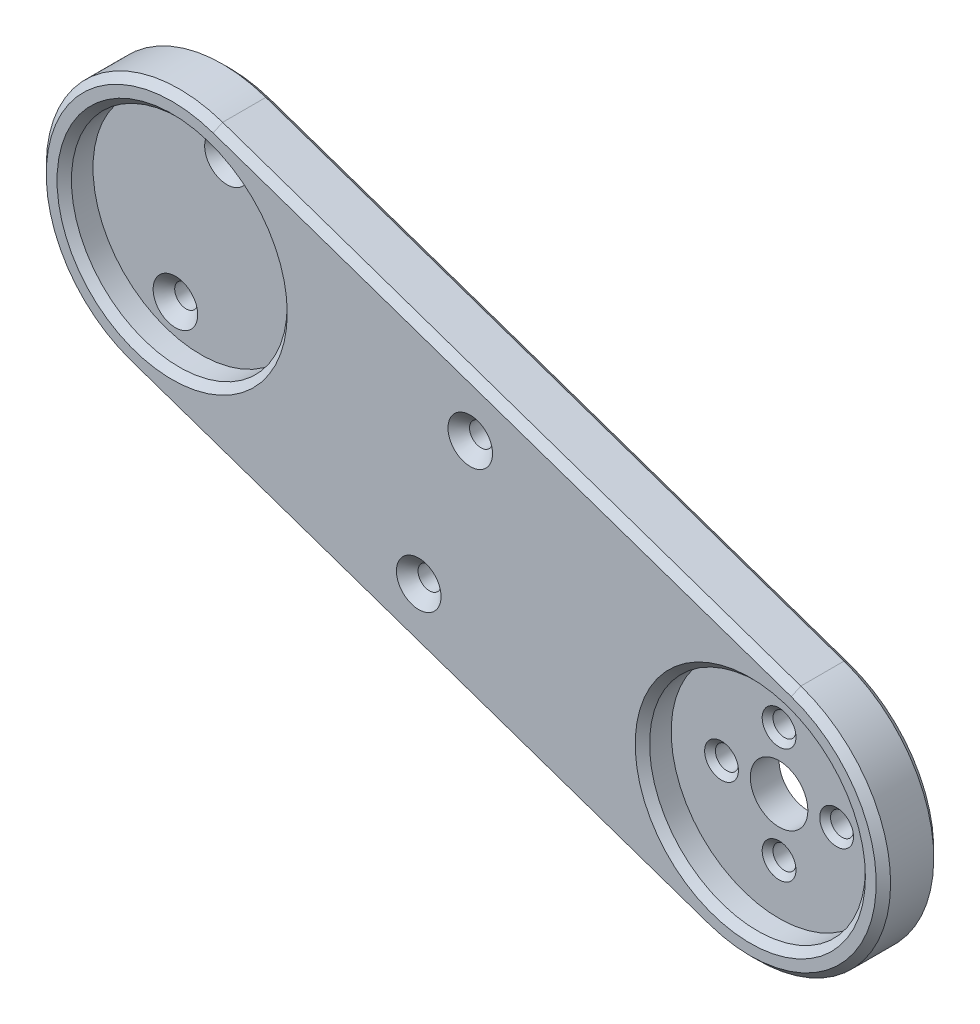
from build123d import *

# Parameters (mm, degrees)
SKETCH1_R               = 15
BOSS_EXTRUDE1_DEPTH     = 8
SKETCH1_5_R             = 15
SKETCH1_5_R_2           = 1.6
BOSS_EXTRUDE4_DEPTH     = 4
CHAMFER1_SIZE           = 0.75
CHAMFER3_SIZE           = 1
CUT_EXTRUDE1_DEPTH      = 109.32973067
CUT_EXTRUDE1_DEPTH_BACK = 109.32973067
SKETCH8_R               = 4
CUT_EXTRUDE2_DEPTH      = 109.32973067
CUT_EXTRUDE2_DEPTH_BACK = 109.32973067
SKETCH10_R              = 1.6
CHAMFER4_SIZE           = 1.5
CHAMFER5_SIZE           = 1
CHAMFER6_SIZE           = 1


with BuildPart() as part:
    # Sketch1 → Boss-Extrude1 (new body)
    with BuildSketch(Plane.XY):
        with BuildLine():
            ThreePointArc((-72.100325672, 47.313455418), (-95.616319813, 35.84619683), (-84.149061225, 12.330202688))
            Line((-84.149061225, 12.330202688), (-3.782129278, -15.349324934))
            ThreePointArc((-3.782129278, -15.349324934), (19.733864864, -3.882066346), (8.266606276, 19.633927796))
            Line((8.266606276, 19.633927796), (-72.100325672, 47.313455418))
        make_face()
        with Locations((2.242238499, 2.142301431)):
            Circle(SKETCH1_R, mode=Mode.SUBTRACT)
        with Locations((-78.124693448, 29.821829053)):
            Circle(SKETCH1_R, mode=Mode.SUBTRACT)
    extrude(amount=BOSS_EXTRUDE1_DEPTH)

    # Sketch1<5> → Boss-Extrude4 (add)
    # profile 1 of 2: a face of its own
    with BuildSketch(Plane.XY):
        with Locations((2.242238499, 2.142301431)):
            Circle(SKETCH1_5_R)
        with Locations((2.242238499, -5.857698569)):
            Circle(SKETCH1_5_R_2, mode=Mode.SUBTRACT)
        with Locations((-5.757761501, 2.142301431)):
            Circle(SKETCH1_5_R_2, mode=Mode.SUBTRACT)
        with Locations((10.242238499, 2.142301431)):
            Circle(SKETCH1_5_R_2, mode=Mode.SUBTRACT)
        with Locations((2.242238499, 10.142301431)):
            Circle(SKETCH1_5_R_2, mode=Mode.SUBTRACT)
    # profile 2 of 2: a face of its own
    with BuildSketch(Plane.XY):
        with Locations((-78.124693448, 29.821829053)):
            Circle(SKETCH1_5_R)
    extrude(amount=BOSS_EXTRUDE4_DEPTH)

    # Chamfer1
    chamfer1_edges = [part.edges().sort_by_distance(p)[0] for p in [
        (-7.357761501, 2.142301431, 4),
        (0.642238499, -5.857698569, 4),
        (8.642238499, 2.142301431, 4),
        (0.642238499, 10.142301431, 4),
    ]]
    chamfer(chamfer1_edges, length=CHAMFER1_SIZE)

    # Chamfer3
    chamfer3_edges = [part.edges().sort_by_distance(p)[0] for p in [
        (-12.757761501, 2.142301431, 8),
        (-93.124693448, 29.821829053, 8),
    ]]
    chamfer(chamfer3_edges, length=CHAMFER3_SIZE)

    # Sketch8 → Cut-Extrude1 (cut, two sides: drawn at the far end of the back side and taken through both)
    with BuildSketch(Plane(origin=(0, 0, 0), x_dir=(-1, 0, 0), z_dir=(0, 0, -1)).offset(-CUT_EXTRUDE1_DEPTH_BACK)):
        with Locations((-2.242238499, 2.142301431)):
            Circle(SKETCH8_R)
    extrude(amount=CUT_EXTRUDE1_DEPTH + CUT_EXTRUDE1_DEPTH_BACK, mode=Mode.SUBTRACT)

    # Sketch10 → Cut-Extrude2 (cut, two sides: drawn at the far end of the back side and taken through both)
    with BuildSketch(Plane(origin=(0, 0, 0), x_dir=(-1, 0, 0), z_dir=(0, 0, -1)).offset(-CUT_EXTRUDE2_DEPTH_BACK)):
        with Locations((74.502789559, 40.208531531)):
            Circle(SKETCH10_R)
        with Locations((36.683056878, 27.182871474)):
            Circle(SKETCH10_R)
        with Locations((81.66690259, 19.407678557)):
            Circle(SKETCH10_R)
        with Locations((43.847169909, 6.382018499)):
            Circle(SKETCH10_R)
    extrude(amount=CUT_EXTRUDE2_DEPTH + CUT_EXTRUDE2_DEPTH_BACK, mode=Mode.SUBTRACT)

    # Chamfer4
    chamfer4_edges = [part.edges().sort_by_distance(p)[0] for p in [
        (-72.902789559, 40.208531531, 4),
        (-42.247169909, 6.382018499, 8),
        (-35.083056878, 27.182871474, 8),
        (-80.06690259, 19.407678557, 4),
    ]]
    chamfer(chamfer4_edges, length=CHAMFER4_SIZE)

    # Chamfer5
    chamfer5_edges = [part.edges().sort_by_distance(p)[0] for p in [
        (-31.916859698, 33.473691607, 0),
        (-95.616319813, 35.84619683, 0),
        (19.733864864, -3.882066346, 0),
        (-43.965595251, -1.509561123, 0),
    ]]
    chamfer(chamfer5_edges, length=CHAMFER5_SIZE)

    # Chamfer6
    chamfer6_edges = [part.edges().sort_by_distance(p)[0] for p in [
        (-31.916859698, 33.473691607, 8),
        (-95.616319813, 35.84619683, 8),
        (19.733864864, -3.882066346, 8),
        (-43.965595251, -1.509561123, 8),
    ]]
    chamfer(chamfer6_edges, length=CHAMFER6_SIZE)


solid = part.part
